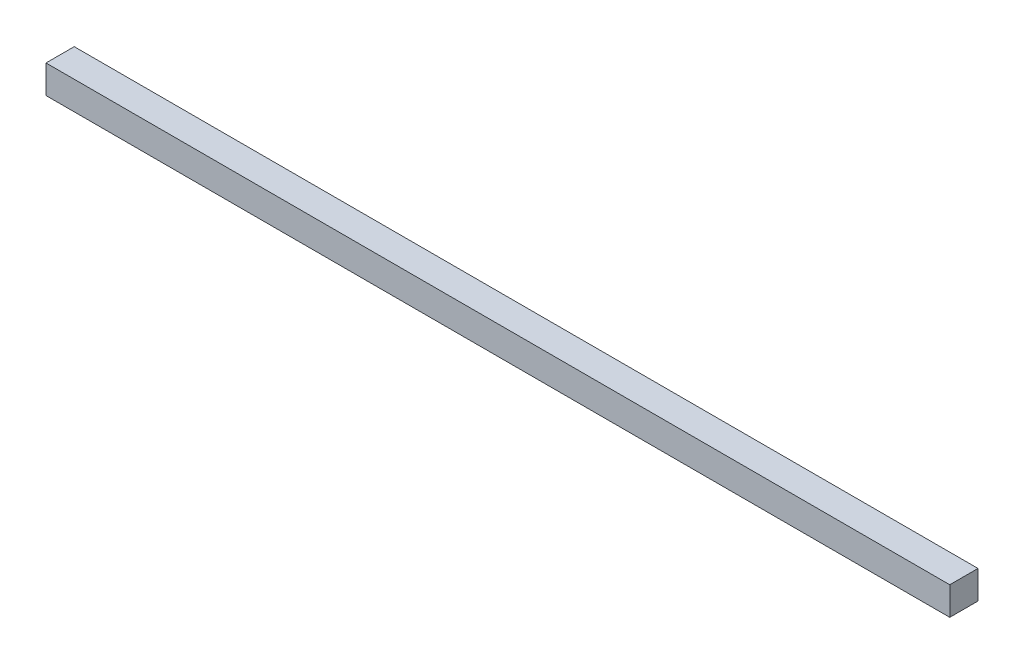
from build123d import *

# Parameters (mm, degrees)
SKETCH1_W           = 1219.2
SKETCH1_H           = 38.1
BOSS_EXTRUDE1_DEPTH = 38.1


with BuildPart() as part:
    # Sketch1 → Boss-Extrude1 (new body)
    with BuildSketch(Plane.XY):
        Rectangle(SKETCH1_W, SKETCH1_H)
    extrude(amount=BOSS_EXTRUDE1_DEPTH)


solid = part.part
